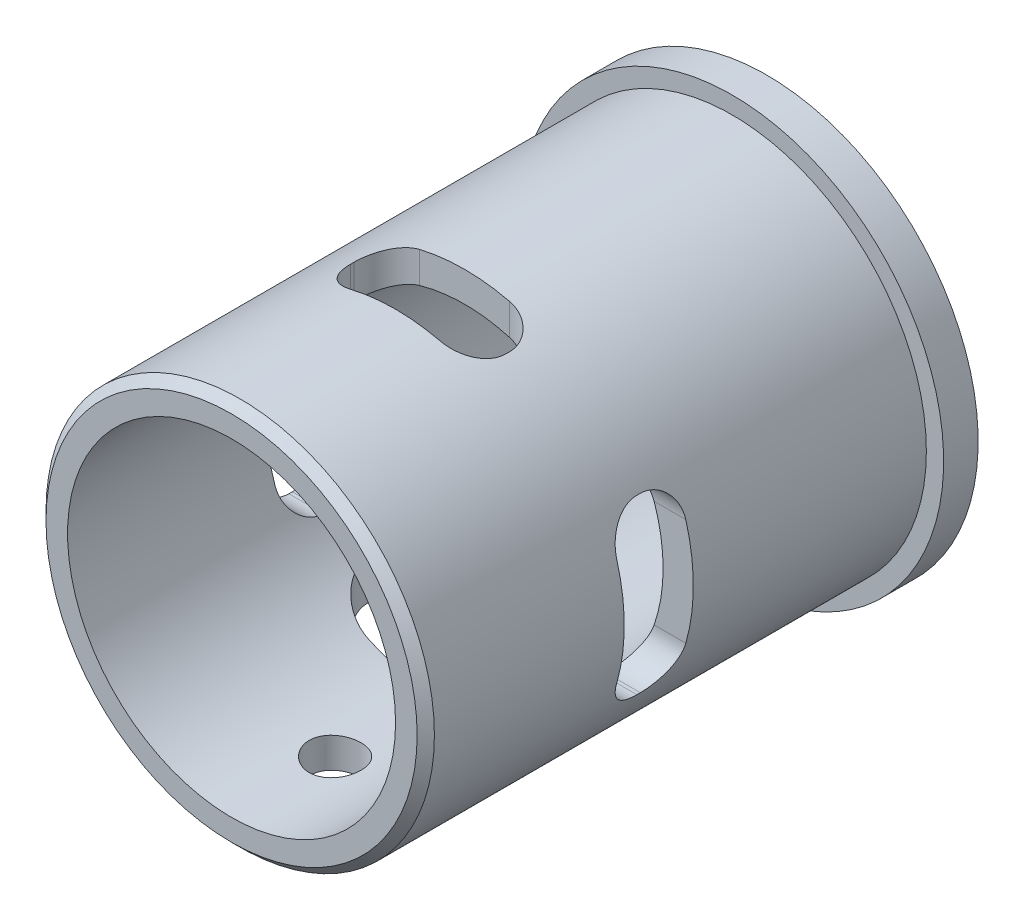
from build123d import *

# Parameters (mm, degrees)
ESQUISSE1_R             = 11.25
ESQUISSE1_R_2           = 9.5
BASE_EXTRUSION_DEPTH    = 31
CHANFREIN1_SIZE         = 0.5
ESQUISSE2_R             = 12.25
ESQUISSE2_R_2           = 11.25
BOSS_EXTRU_MINCE1_DEPTH = 2
ESQUISSE3_R             = 1.5
ENL_V_MAT_EXTRU_1_DEPTH = 36.512321805
ENL_V_MAT_EXTRU_2_DEPTH = 25
ENL_V_MAT_EXTRU_3_DEPTH = 50


with BuildPart() as part:
    # Esquisse1 → Base-Extrusion (new body)
    with BuildSketch(Plane.XY):
        Circle(ESQUISSE1_R)
        Circle(ESQUISSE1_R_2, mode=Mode.SUBTRACT)
    extrude(amount=BASE_EXTRUSION_DEPTH)

    # Chanfrein1
    chanfrein1_edges = [part.edges().sort_by_distance(p)[0] for p in [
        (-11.25, 0, 31),
    ]]
    chamfer(chanfrein1_edges, length=CHANFREIN1_SIZE)

    # Esquisse2 → Boss.-Extru.-Mince1 (add)
    with BuildSketch(Plane(origin=(0, 0, 0), x_dir=(-1, 0, 0), z_dir=(0, 0, -1))):
        Circle(ESQUISSE2_R)
        Circle(ESQUISSE2_R_2, mode=Mode.SUBTRACT)
    extrude(amount=-BOSS_EXTRU_MINCE1_DEPTH)

    # Esquisse3 → Enlèv. mat.-Extru.1 (cut, through all)
    with BuildSketch(Plane(origin=(0, 0, 0), x_dir=(1, 0, 0), z_dir=(0, 1, 0))):
        with Locations(Location((0, -25, 0), (0, 0, 270))):
            Circle(ESQUISSE3_R)
        with BuildLine():
            Line((-4.1, -14), (4.1, -14))
            ThreePointArc((4.1, -14), (5.797056275, -14.702943725), (6.5, -16.4))
            Line((6.5, -16.4), (6.5, -16.6))
            ThreePointArc((6.5, -16.6), (5.797056275, -18.297056275), (4.1, -19))
            Line((4.1, -19), (-4.1, -19))
            ThreePointArc((-4.1, -19), (-5.797056275, -18.297056275), (-6.5, -16.6))
            Line((-6.5, -16.6), (-6.5, -16.4))
            ThreePointArc((-6.5, -16.4), (-5.797056275, -14.702943725), (-4.1, -14))
        make_face()
    extrude(amount=-ENL_V_MAT_EXTRU_1_DEPTH, mode=Mode.SUBTRACT)

    # Esquisse4 → Enlèv. mat.-Extru.2 (cut, symmetric)
    with BuildSketch(Plane(origin=(0, 0, 0), x_dir=(0, 0, -1), z_dir=(1, 0, 0))):
        with BuildLine():
            Line((-17.6, 5), (-17.4, 5))
            ThreePointArc((-17.4, 5), (-16.056497116, 4.443502884), (-15.5, 3.1))
            Line((-15.5, 3.1), (-15.5, -3.1))
            ThreePointArc((-15.5, -3.1), (-16.056497116, -4.443502884), (-17.4, -5))
            Line((-17.4, -5), (-17.6, -5))
            ThreePointArc((-17.6, -5), (-18.943502884, -4.443502884), (-19.5, -3.1))
            Line((-19.5, -3.1), (-19.5, 3.1))
            ThreePointArc((-19.5, 3.1), (-18.943502884, 4.443502884), (-17.6, 5))
        make_face()
    extrude(amount=ENL_V_MAT_EXTRU_2_DEPTH, both=True, mode=Mode.SUBTRACT)

    # Esquisse5 → Enlèv. mat.-Extru.3 (cut)
    with BuildSketch(Plane(origin=(0, 0, 0), x_dir=(1, 0, 0), z_dir=(0, 1, 0))):
        with BuildLine():
            Line((-2.6, -17.5), (2.6, -17.5))
            ThreePointArc((2.6, -17.5), (3.943502884, -18.056497116), (4.5, -19.4))
            Line((4.5, -19.4), (4.5, -19.6))
            ThreePointArc((4.5, -19.6), (3.943502884, -20.943502884), (2.6, -21.5))
            Line((2.6, -21.5), (-2.6, -21.5))
            ThreePointArc((-2.6, -21.5), (-3.943502884, -20.943502884), (-4.5, -19.6))
            Line((-4.5, -19.6), (-4.5, -19.4))
            ThreePointArc((-4.5, -19.4), (-3.943502884, -18.056497116), (-2.6, -17.5))
        make_face()
    extrude(amount=ENL_V_MAT_EXTRU_3_DEPTH, mode=Mode.SUBTRACT)


solid = part.part
